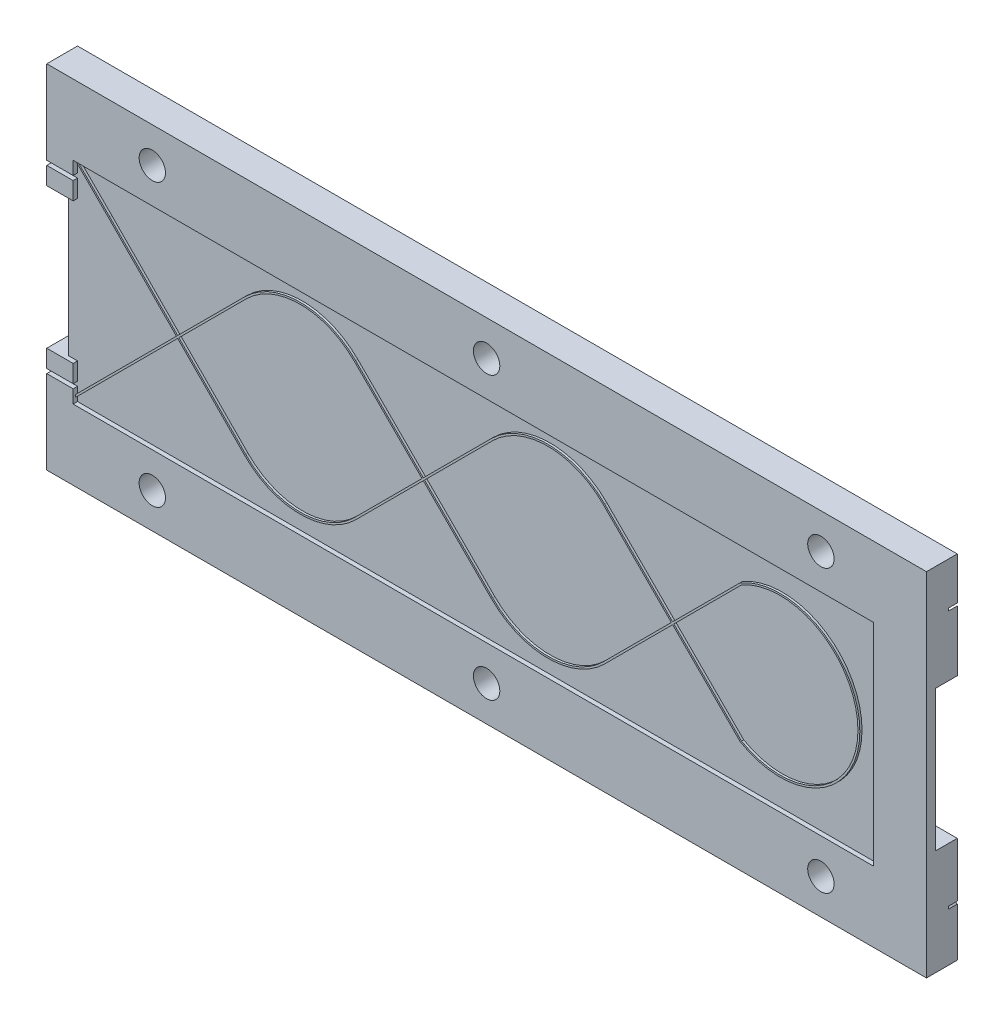
from build123d import *

# Parameters (mm, degrees)
SKETCH1_W             = 100
SKETCH1_H             = 40
BOSS_EXTRUDE1_DEPTH   = 3
BOSS_EXTRUDE2_DEPTH   = 0.25
BOSS_EXTRUDE21_DEPTH  = 0.5
CUT_EXTRUDE51_DEPTH   = 1
F_3_0MM_DOWEL_HOLE1_D = 3
CUT_EXTRUDE52_START   = -12
CUT_EXTRUDE52_DEPTH   = 16
SKETCH38_W            = 3
SKETCH38_H            = 0.5
SKETCH38_H_2          = 0.498463084
CUT_EXTRUDE53_DEPTH   = 0.5


with BuildPart() as part:
    # Sketch1 → Boss-Extrude1 (new body)
    with BuildSketch(Plane.XY):
        with Locations((50, -20)):
            Rectangle(SKETCH1_W, SKETCH1_H)
    extrude(amount=BOSS_EXTRUDE1_DEPTH)



with BuildPart() as body_2:
    # Sketch15 → Boss-Extrude2 (new body)
    with BuildSketch(Plane.XY.offset(3)):
        with BuildLine():
            Line((6.768599112, -11.887878533), (14.489844294, -19.704001121))
            Line((14.489844294, -19.704001121), (4.37258998, -29.821255436))
            Line((4.37258998, -29.821255436), (3, -31.193845416))
            Line((3, -31.193845416), (3, -31.476688128))
            Line((3, -31.476688128), (4.514011336, -29.962676792))
            Line((4.514011336, -29.962676792), (14.630402075, -19.846286053))
            Line((14.630402075, -19.846286053), (22.229666729, -27.538929237))
            ThreePointArc((22.229666729, -27.538929237), (28.540816637, -30.187020221), (34.868018887, -27.577516304))
            Line((34.868018887, -27.577516304), (42.552442419, -19.893092772))
            Line((42.552442419, -19.893092772), (50.282946717, -27.623597071))
            ThreePointArc((50.282946717, -27.623597071), (56.724368073, -30.291721157), (63.16578943, -27.623597071))
            Line((63.16578943, -27.623597071), (70.896293728, -19.893092772))
            Line((70.896293728, -19.893092772), (78.58071726, -27.577516304))
            ThreePointArc((78.58071726, -27.577516304), (92.175896221, -19.751671416), (78.58071726, -11.925826528))
            Line((78.58071726, -11.925826528), (70.896293728, -19.61025006))
            Line((70.896293728, -19.61025006), (63.16578943, -11.879745762))
            ThreePointArc((63.16578943, -11.879745762), (56.724368073, -9.211621675), (50.282946717, -11.879745762))
            Line((50.282946717, -11.879745762), (42.552442419, -19.61025006))
            Line((42.552442419, -19.61025006), (34.868018887, -11.925826528))
            ThreePointArc((34.868018887, -11.925826528), (28.568018887, -9.316281085), (22.268018887, -11.925826528))
            Line((22.268018887, -11.925826528), (14.631268287, -19.562577129))
            Line((14.631268287, -19.562577129), (6.910881392, -11.747323373))
            Line((6.910881392, -11.747323373), (3.163558019, -8))
            Line((3.163558019, -8), (3, -8))
            Line((3, -8), (3, -8.119279421))
            Line((3, -8.119279421), (6.768599112, -11.887878533))
        make_face()
        with BuildLine():
            Line((22.371949008, -27.398374077), (14.771826068, -19.70486206))
            Line((14.771826068, -19.70486206), (22.409440244, -12.067247885))
            ThreePointArc((22.409440244, -12.067247885), (28.568018887, -9.516281085), (34.726597531, -12.067247885))
            Line((34.726597531, -12.067247885), (42.411021063, -19.751671416))
            Line((42.411021063, -19.751671416), (34.726597531, -27.436094948))
            ThreePointArc((34.726597531, -27.436094948), (28.541427268, -29.987021153), (22.371949008, -27.398374077))
        make_face(mode=Mode.SUBTRACT)
        with BuildLine():
            Line((70.754872372, -19.751671416), (63.024368073, -27.482175714))
            ThreePointArc((63.024368073, -27.482175714), (56.724368073, -30.091721157), (50.424368073, -27.482175714))
            Line((50.424368073, -27.482175714), (42.693863775, -19.751671416))
            Line((42.693863775, -19.751671416), (50.424368073, -12.021167118))
            ThreePointArc((50.424368073, -12.021167118), (56.724368073, -9.411621675), (63.024368073, -12.021167118))
            Line((63.024368073, -12.021167118), (70.754872372, -19.751671416))
        make_face(mode=Mode.SUBTRACT)
        with BuildLine():
            Line((71.037715084, -19.751671416), (78.722138616, -12.067247885))
            ThreePointArc((78.722138616, -12.067247885), (91.962142601, -19.751671416), (78.722138616, -27.436094948))
            Line((78.722138616, -27.436094948), (71.037715084, -19.751671416))
        make_face(mode=Mode.SUBTRACT)
    extrude(amount=BOSS_EXTRUDE2_DEPTH)


with BuildPart() as part_1:
    add(part.part)

    add(body_2.part)  # Boss-Extrude21 merges body 2
    # Sketch15<71> → Boss-Extrude21 (add)
    with BuildSketch(Plane.XY.offset(3)):
        Polygon((3, -31.476688128), (3, -31.193845416), (3, -28), (0, -28), (0, -40), (100, -40), (100, 0), (0, 0), (0, -12), (3, -12), (3, -8.119279421), (3, -8), (3.163558019, -8), (94, -8), (94, -32), (3, -32), align=None)
    extrude(amount=BOSS_EXTRUDE21_DEPTH)

    # Sketch16 → Cut-Extrude51 (cut)
    with BuildSketch(Plane.XY):
        Polygon((96.84, -8), (6, -8), (6, -32), (97, -32), (97, -31.48), (100, -34.48), (100, -34.19), (97, -31.19), (97, -28), (100, -28), (100, -12), (97, -12), (97, -8.12), (100, -5.12), (100, -4.84), align=None)
    extrude(amount=CUT_EXTRUDE51_DEPTH, mode=Mode.SUBTRACT)

    # Ø3.0mm Dowel Hole1 (through all)
    with Locations(Plane.XY.offset(3.5)):
        with Locations((12, -4), (50, -4), (88, -4), (88, -36), (50, -36), (12, -36)):
            Hole(F_3_0MM_DOWEL_HOLE1_D / 2)

    # Sketch37 → Cut-Extrude52 (cut)
    with BuildSketch(Plane(origin=(0, -40, 0), x_dir=(-1, 0, 0), z_dir=(0, -1, 0)).offset(CUT_EXTRUDE52_START)):
        Polygon((0, -3.5), (-2.5, -3.5), (0, -1), align=None)
        Polygon((-100, 0), (-97.5, 0), (-100, -2.5), align=None)
    extrude(amount=-CUT_EXTRUDE52_DEPTH, mode=Mode.SUBTRACT)

    # Sketch38 → Cut-Extrude53 (cut)
    with BuildSketch(Plane.XY.offset(3.5)):
        with Locations((1.5, -9.75)):
            Rectangle(SKETCH38_W, SKETCH38_H)
        with Locations((1.5, -30.249231542)):
            Rectangle(SKETCH38_W, SKETCH38_H_2)
    extrude(amount=-CUT_EXTRUDE53_DEPTH, mode=Mode.SUBTRACT)


solid = part_1.part
